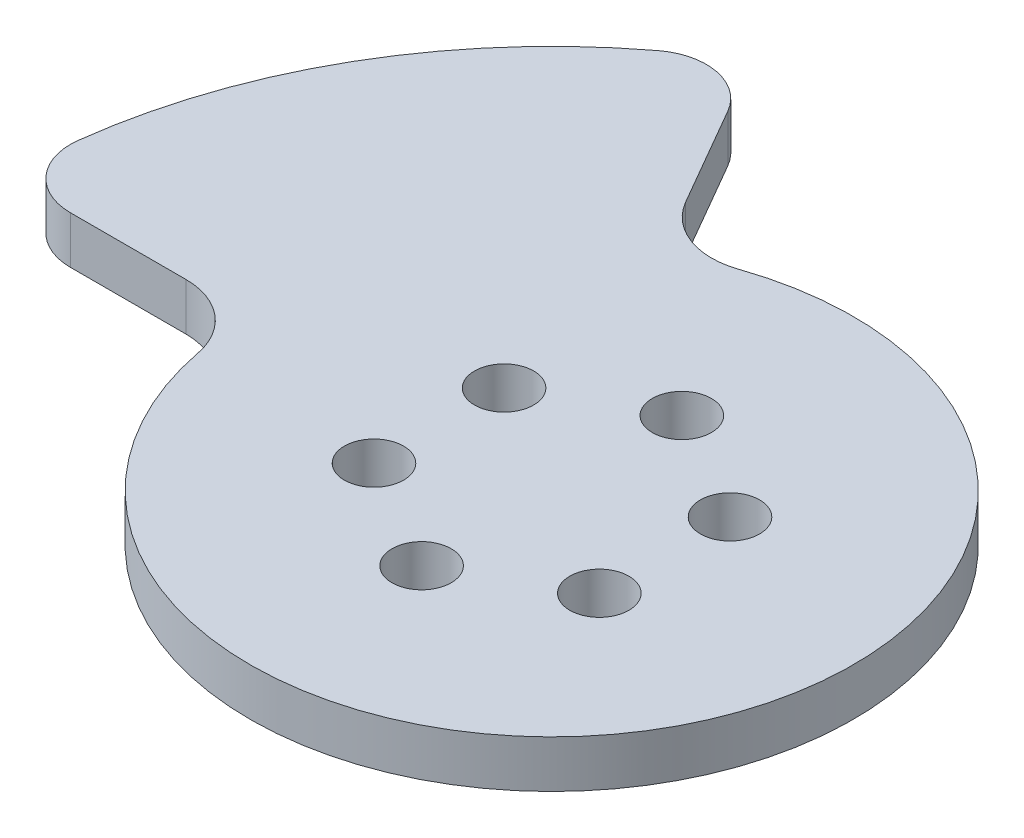
from build123d import *

# Parameters (mm, degrees)
SKETCH_1_R      = 2.5
EXTRUDE_1_DEPTH = 4


with BuildPart() as part:
    # 草图1 → 凸台-拉伸1 (new body)
    with BuildSketch(Plane(origin=(0, 0, 0), x_dir=(1, 0, 0), z_dir=(0, 1, 0))):
        with BuildLine():
            Line((-20.346989949, 35.242020373), (-15.461646096, 26.780356607))
            ThreePointArc((-15.461646096, 26.780356607), (-12.365785271, 24.159967367), (-8.310161545, 24.10790773))
            ThreePointArc((-8.310161545, 24.10790773), (22.083647797, -12.75), (-25.033141298, -4.857142857))
            ThreePointArc((-25.033141298, -4.857142857), (-27.10603813, -1.370899501), (-30.923292192, 0))
            Line((-30.923292192, 0), (-40.693979899, 0))
            ThreePointArc((-40.693979899, 0), (-44.438895151, 1.687054218), (-45.656660374, 5.609756098))
            ThreePointArc((-45.656660374, 5.609756098), (-39.837168574, 23), (-27.686521477, 36.734949687))
            ThreePointArc((-27.686521477, 36.734949687), (-23.680479385, 37.641685008), (-20.346989949, 35.242020373))
        make_face()
        with Locations(Location((0, 11, 0), (0, 0, 270))):
            Circle(SKETCH_1_R, mode=Mode.SUBTRACT)
        with Locations(Location((9.462063016, 5.609756098, 0), (0, 0, 270))):
            Circle(SKETCH_1_R, mode=Mode.SUBTRACT)
        with Locations(Location((9.526279442, -5.5, 0), (0, 0, 270))):
            Circle(SKETCH_1_R, mode=Mode.SUBTRACT)
        with Locations(Location((0, -11, 0), (0, 0, 270))):
            Circle(SKETCH_1_R, mode=Mode.SUBTRACT)
        with Locations(Location((-9.526279442, -5.5, 0), (0, 0, 270))):
            Circle(SKETCH_1_R, mode=Mode.SUBTRACT)
        with Locations(Location((-9.526279442, 5.5, 0), (0, 0, 270))):
            Circle(SKETCH_1_R, mode=Mode.SUBTRACT)
    extrude(amount=EXTRUDE_1_DEPTH)


solid = part.part
